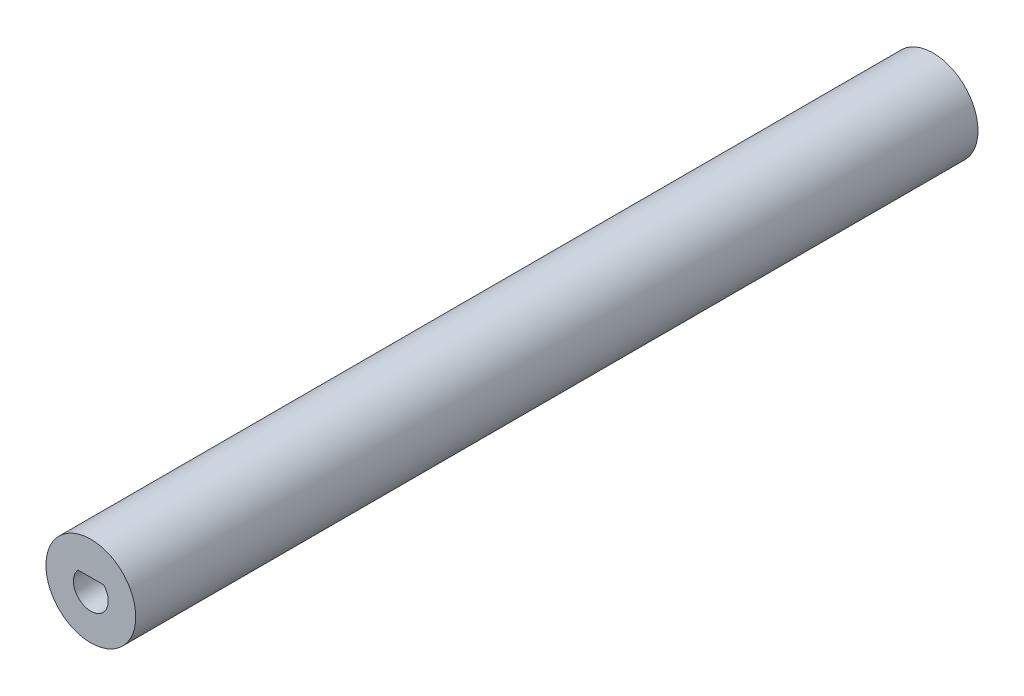
from build123d import *

# Parameters (mm, degrees)
IZIM1_R                     = 4
Y_KSEKLIK_EKSTR_ZYON1_DEPTH = 75
KES_EKSTR_ZYON1_DEPTH       = 7


with BuildPart() as part:
    # Çizim1 → Yükseklik-Ekstrüzyon1 (new body)
    with BuildSketch(Plane.XY):
        Circle(IZIM1_R)
    extrude(amount=Y_KSEKLIK_EKSTR_ZYON1_DEPTH)

    # Çizim2 → Kes-Ekstrüzyon1 (cut)
    with BuildSketch(Plane.XY.offset(75)):
        with BuildLine():
            Line((-1.140175425, 1.05), (1.140175425, 1.05))
            ThreePointArc((1.140175425, 1.05), (0, -1.55), (-1.140175425, 1.05))
        make_face()
    extrude(amount=-KES_EKSTR_ZYON1_DEPTH, mode=Mode.SUBTRACT)


solid = part.part
